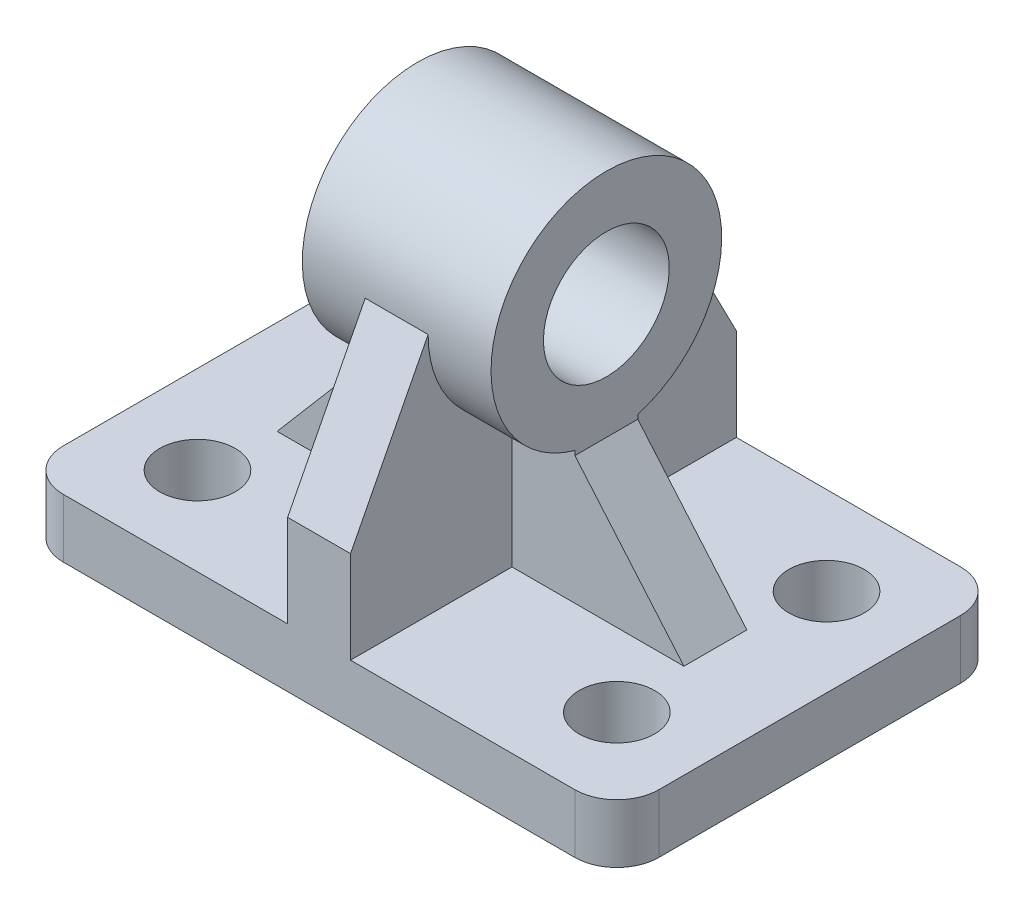
from build123d import *

# Parameters (mm, degrees)
SKETCH1_W           = 142
SKETCH1_H           = 92
BOSS_EXTRUDE1_DEPTH = 14
FILLET1_R           = 10
SKETCH2_R           = 27.5
SKETCH2_R_2         = 15
BOSS_EXTRUDE2_DEPTH = 22.5
BOSS_EXTRUDE3_DEPTH = 7.5
BOSS_EXTRUDE4_DEPTH = 7.5
SKETCH5_R           = 9
CUT_EXTRUDE1_DEPTH  = 121.279881942


with BuildPart() as part:
    # Sketch1 → Boss-Extrude1 (new body)
    with BuildSketch(Plane(origin=(0, 0, 0), x_dir=(1, 0, 0), z_dir=(0, 1, 0))):
        Rectangle(SKETCH1_W, SKETCH1_H)
    extrude(amount=BOSS_EXTRUDE1_DEPTH)

    # Fillet1
    fillet1_edges = [part.edges().sort_by_distance(p)[0] for p in [
        (-71, 7, -46),
        (71, 7, -46),
        (71, 7, 46),
        (-71, 7, 46),
    ]]
    fillet(fillet1_edges, radius=FILLET1_R)



with BuildPart() as body_2:
    # Sketch2 → Boss-Extrude2 (new, symmetric)
    with BuildSketch(Plane(origin=(0, 0, 0), x_dir=(0, 0, -1), z_dir=(1, 0, 0))):
        with Locations(Location((0, 72, 0), (0, 0, 180))):
            Circle(SKETCH2_R)
        with Locations(Location((0, 72, 0), (0, 0, 180))):
            Circle(SKETCH2_R_2, mode=Mode.SUBTRACT)
    extrude(amount=BOSS_EXTRUDE2_DEPTH, both=True)


with BuildPart() as part_1:
    add(part.part)

    add(body_2.part)  # Boss-Extrude3 merges body 2
    # Sketch3 → Boss-Extrude3 (add, symmetric)
    with BuildSketch(Plane.XY):
        Polygon((0, 49.5), (-22.5, 49.5), (-22.5, 44.5), (-48.5, 14), (-48.5, 6.529967444), (0, 6.529967444), (0, 44.5), align=None)
    extrude(amount=BOSS_EXTRUDE3_DEPTH, both=True)

    # Mirror1: part across plane


with BuildPart() as part_2:
    add(part_1.part)
    add(part_1.part.mirror(Plane(origin=(0, 0, 0), x_dir=(0, 0, 1), z_dir=(1, 0, 0))))

    # Sketch4 → Boss-Extrude4 (add, symmetric)
    with BuildSketch(Plane(origin=(0, 0, 0), x_dir=(0, 0, -1), z_dir=(1, 0, 0))):
        with BuildLine():
            Line((7.5, 14), (36, 14))
            Line((36, 14), (46, 14))
            Line((46, 14), (46, 36))
            Line((46, 36), (27.5, 72))
            ThreePointArc((27.5, 72), (21.937410968, 55.416876048), (7.5, 45.542486889))
            Line((7.5, 45.542486889), (7.5, 44.5))
            Line((7.5, 44.5), (7.5, 14))
        make_face()
    extrude(amount=BOSS_EXTRUDE4_DEPTH, both=True)

    # Mirror3: part across plane


with BuildPart() as part_3:
    add(part_2.part)
    add(part_2.part.mirror(Plane.XY))

    # Sketch5 → Cut-Extrude1 (cut, through all)
    with BuildSketch(Plane(origin=(0, 14, 0), x_dir=(1, 0, 0), z_dir=(0, 1, 0))):
        with Locations(Location((50, -25, 0), (0, 0, 270))):
            Circle(SKETCH5_R)
        with Locations(Location((50, 25, 0), (0, 0, 270))):
            Circle(SKETCH5_R)
        with Locations(Location((-50, 25, 0), (0, 0, 90))):
            Circle(SKETCH5_R)
        with Locations(Location((-50, -25, 0), (0, 0, 90))):
            Circle(SKETCH5_R)
    extrude(amount=-CUT_EXTRUDE1_DEPTH, mode=Mode.SUBTRACT)


solid = part_3.part
